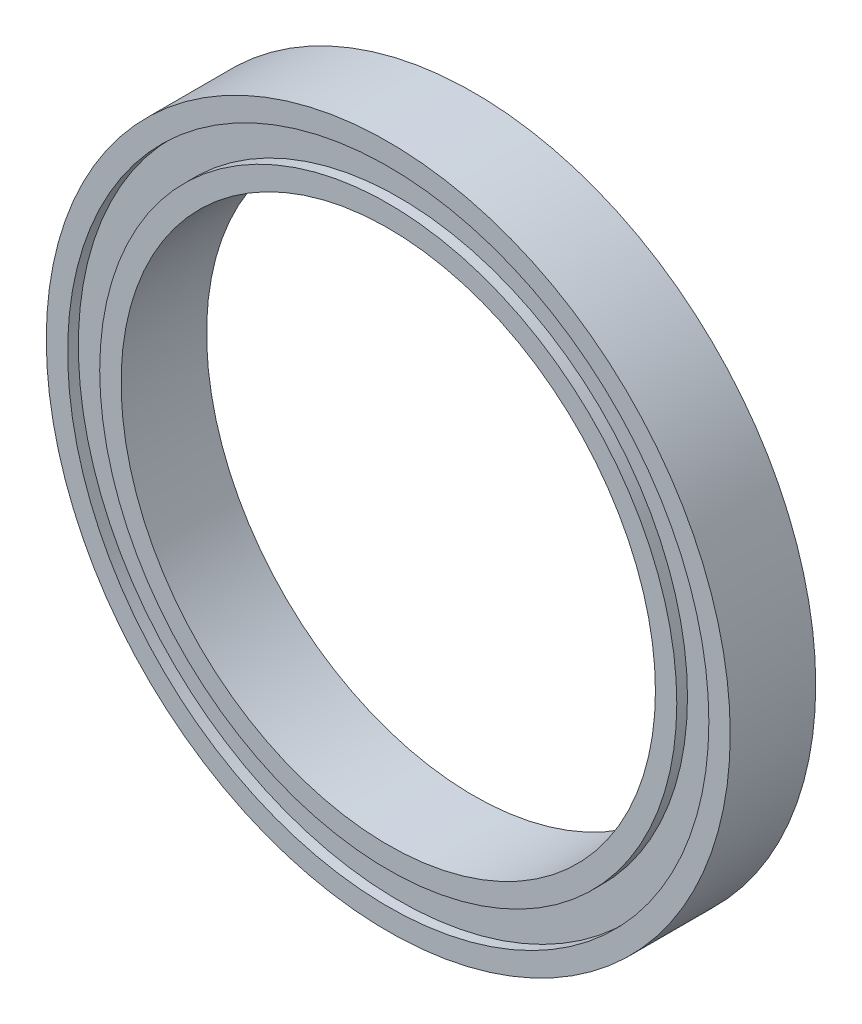
from build123d import *

# Parameters (mm, degrees)
SKETCH1_R             = 13.5
SKETCH1_R_2           = 12.5
BOSS_EXTRUDE1_DEPTH   = 4
SKETCH1_R_3           = 16
SKETCH1_R_4           = 15
BOSS_EXTRUDE1_2_DEPTH = 4
BOSS_EXTRUDE2_START   = -3.5
SKETCH2_R             = 15
SKETCH2_R_2           = 13.5
BOSS_EXTRUDE2_DEPTH   = 3


with BuildPart() as part:
    # Sketch1 → Boss-Extrude1 (new body)
    with BuildSketch(Plane.XY):
        Circle(SKETCH1_R)
        Circle(SKETCH1_R_2, mode=Mode.SUBTRACT)
    extrude(amount=BOSS_EXTRUDE1_DEPTH)



with BuildPart() as body_2:
    # Sketch1 → Boss-Extrude1 2 (new body)
    with BuildSketch(Plane.XY):
        Circle(SKETCH1_R_3)
        Circle(SKETCH1_R_4, mode=Mode.SUBTRACT)
    extrude(amount=BOSS_EXTRUDE1_2_DEPTH)


with BuildPart() as part_1:
    add(part.part)

    add(body_2.part)  # Boss-Extrude2 merges body 2
    # Sketch2 → Boss-Extrude2 (add)
    with BuildSketch(Plane.XY.offset(4).offset(BOSS_EXTRUDE2_START)):
        Circle(SKETCH2_R)
        Circle(SKETCH2_R_2, mode=Mode.SUBTRACT)
    extrude(amount=BOSS_EXTRUDE2_DEPTH)


solid = part_1.part
